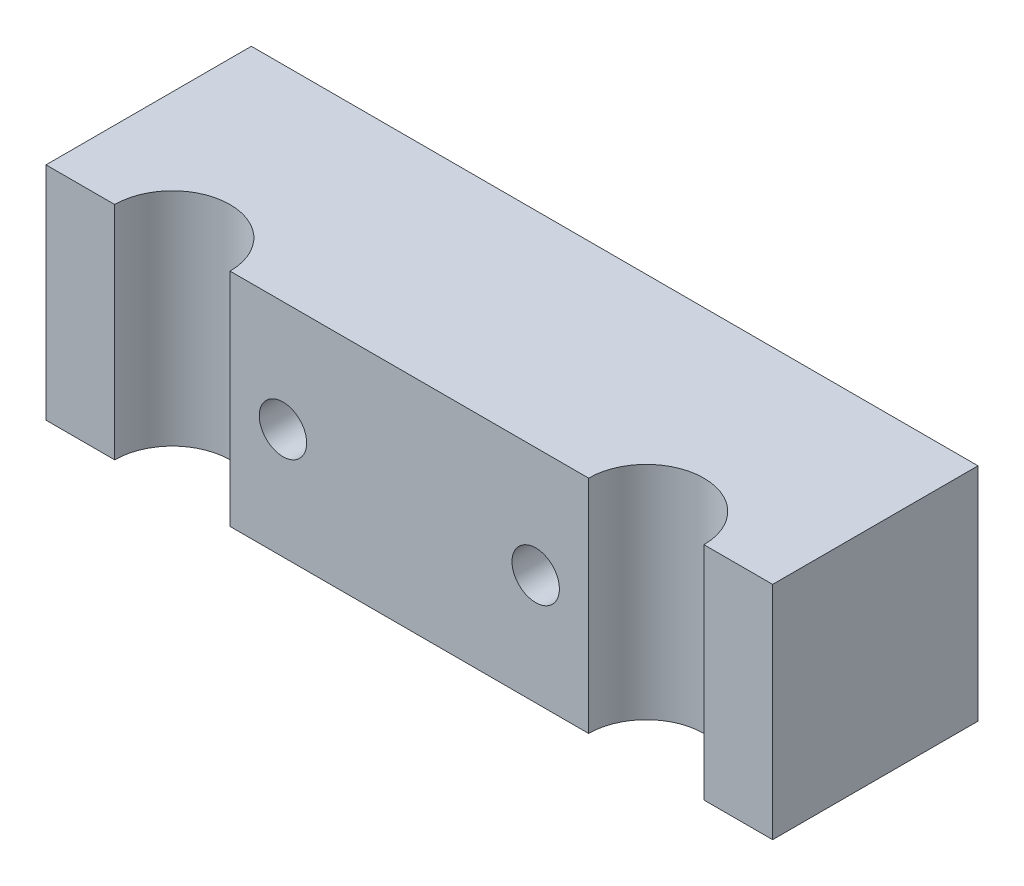
from build123d import *

# Parameters (mm, degrees)
SKETCH_1_W          = 46
SKETCH_1_H          = 14
EXTRUDE_1_DEPTH     = 13
CUT_EXTRUDE_1_REACH = 29.331
SKETCH_2_R          = 1.5
CUT_EXTRUDE_2_REACH = 31.9
SKETCH_3_R          = 3.65
SKETCH_4_R          = 3
CUT_EXTRUDE_3_DEPTH = 3.8


with BuildPart() as part:
    # Эскиз1 → Бобышка-Вытянуть1 (new body)
    with BuildSketch(Plane.XY):
        Rectangle(SKETCH_1_W, SKETCH_1_H)
    extrude(amount=EXTRUDE_1_DEPTH)

    # Эскиз2 → Вырез-Вытянуть1 (cut, up to next)
    with BuildSketch(Plane.XY.offset(13), mode=Mode.PRIVATE) as cut_extrude_1_sk1:
        with Locations((-8, 0)):
            Circle(SKETCH_2_R)
    cut_extrude_1_tool1 = extrude(cut_extrude_1_sk1.sketch, amount=-CUT_EXTRUDE_1_REACH, mode=Mode.PRIVATE) & part.part
    # Эскиз2 → Вырез-Вытянуть1 (cut, up to next)
    with BuildSketch(Plane.XY.offset(13), mode=Mode.PRIVATE) as cut_extrude_1_sk2:
        with Locations(Location((8, 0, 0), (0, 0, 180))):
            Circle(SKETCH_2_R)
    cut_extrude_1_tool2 = extrude(cut_extrude_1_sk2.sketch, amount=-CUT_EXTRUDE_1_REACH, mode=Mode.PRIVATE) & part.part
    add(cut_extrude_1_tool1.solids().sort_by_distance((-8, 0, 13))[0], mode=Mode.SUBTRACT)
    add(cut_extrude_1_tool2.solids().sort_by_distance((8, 0, 13))[0], mode=Mode.SUBTRACT)

    # Эскиз3 → Вырез-Вытянуть2 (cut, up to next)
    with BuildSketch(Plane(origin=(0, 7, 0), x_dir=(1, 0, 0), z_dir=(0, 1, 0)), mode=Mode.PRIVATE) as cut_extrude_2_sk1:
        with Locations((-15, -13)):
            Circle(SKETCH_3_R)
    cut_extrude_2_tool1 = extrude(cut_extrude_2_sk1.sketch, amount=-CUT_EXTRUDE_2_REACH, mode=Mode.PRIVATE) & part.part
    # Эскиз3 → Вырез-Вытянуть2 (cut, up to next)
    with BuildSketch(Plane(origin=(0, 7, 0), x_dir=(1, 0, 0), z_dir=(0, 1, 0)), mode=Mode.PRIVATE) as cut_extrude_2_sk2:
        with Locations((15, -13)):
            Circle(SKETCH_3_R)
    cut_extrude_2_tool2 = extrude(cut_extrude_2_sk2.sketch, amount=-CUT_EXTRUDE_2_REACH, mode=Mode.PRIVATE) & part.part
    add(cut_extrude_2_tool1.solids().sort_by_distance((-15, 7, 13))[0], mode=Mode.SUBTRACT)
    add(cut_extrude_2_tool2.solids().sort_by_distance((15, 7, 13))[0], mode=Mode.SUBTRACT)

    # Эскиз4 → Вырез-Вытянуть3 (cut)
    with BuildSketch(Plane(origin=(0, 0, 0), x_dir=(-1, 0, 0), z_dir=(0, 0, -1))):
        with Locations((-8, 0)):
            Circle(SKETCH_4_R)
        with Locations((8, 0)):
            Circle(SKETCH_4_R)
    extrude(amount=-CUT_EXTRUDE_3_DEPTH, mode=Mode.SUBTRACT)


solid = part.part
